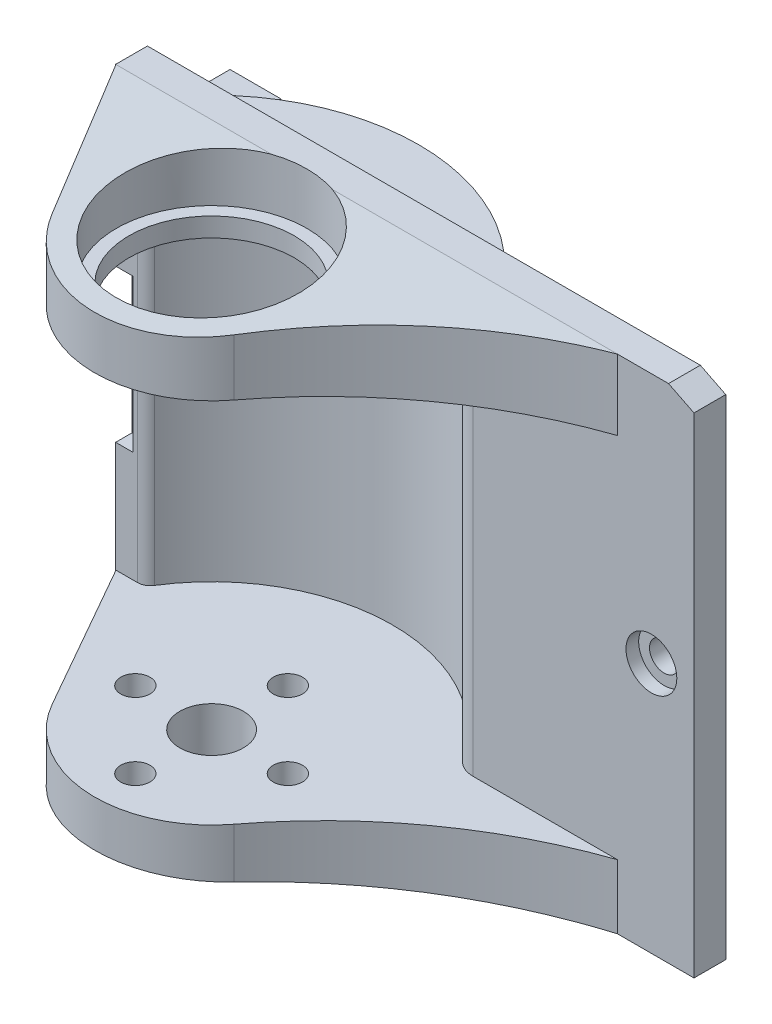
from build123d import *

# Parameters (mm, degrees)
SKETCH_1_R               = 16.3
EXTRUDE_1_DEPTH          = 19.75
SKETCH_2_W               = 46.5
SKETCH_2_H               = 2.5
EXTRUDE_2_DEPTH          = 39.5
SKETCH_3_W               = 54.844436064
SKETCH_3_H               = 25.506740045
CUT_EXTRUDE_1_DEPTH      = 50
EXTRUDE_3_DEPTH          = 5.05
SKETCH_5_R               = 14.25
CUT_EXTRUDE_2_DEPTH      = 29.4
SKETCH_6_R               = 2.5
CUT_EXTRUDE_3_DEPTH      = 50.668048079
CUT_EXTRUDE_6_REACH      = 55.295
SKETCH_9_R               = 7.5
SKETCH_12_R              = 1.15
CUT_EXTRUDE_9_DEPTH      = 41.867774591
SKETCH_13_R              = 2
CUT_EXTRUDE_10_DEPTH     = 1
SKETCH_15_W              = 2.8
SKETCH_15_H              = 12
CUT_EXTRUDE_12_DEPTH     = 1.3
EXTRUDE_5_REACH          = 46.665
EXTRUDE_5_END_RADIUS     = 16.3
SKETCH_16_W              = 4
SKETCH_16_H              = 5
SKETCH_17_W              = 1
SKETCH_17_H              = 2
CUT_EXTRUDE_13_DEPTH     = 2.5
SKETCH_19_R              = 8.51898124
SKETCH_19_R_2            = 6.5
EXTRUDE_6_DEPTH          = 2.25
CUT_EXTRUDE_18_REACH     = 55.295
SKETCH_20_R              = 1.15
PATTERN_CIRCULAR_1_COUNT = 4
CUT_EXTRUDE_8_DEPTH      = 54.084861307
SKETCH_18_W              = 26.346157216
SKETCH_18_H              = 2.75
CUT_EXTRUDE_16_DEPTH     = 12.5
FILLET_1_R               = 2
FILLET_2_R               = 1
SKETCH_21_R              = 2.1
CUT_EXTRUDE_19_DEPTH     = 2.5
CUT_EXTRUDE_START        = -10
SKETCH_22_R              = 7.5
CUT_EXTRUDE_23_DEPTH     = 10
EXTRUDE_START            = -1
SKETCH_23_R              = 7.5
SKETCH_23_R_2            = 6.5
EXTRUDE_7_DEPTH          = 1
MOVE_FACE_3_BY           = 0.5
SKETCH_27_W              = 1
SKETCH_27_H              = 39.5
CUT_EXTRUDE_24_DEPTH     = 41.867774591
CHAMFER_1_SIZE           = 2
CHAMFER_1_SIZE2          = 1


with BuildPart() as part:
    # 草图1 → 凸台-拉伸1 (new, symmetric)
    with BuildSketch(Plane(origin=(0, 0, 0), x_dir=(1, 0, 0), z_dir=(0, 1, 0))):
        with Locations(Location((0, 0, 0), (0, 0, 270))):
            Circle(SKETCH_1_R)
    extrude(amount=EXTRUDE_1_DEPTH, both=True)

    # 草图2 → 凸台-拉伸2 (add, through all)
    with BuildSketch(Plane.XZ.offset(19.75)):
        with Locations((8.6, -8.35)):
            Rectangle(SKETCH_2_W, SKETCH_2_H)
    extrude(amount=-EXTRUDE_2_DEPTH)

    # 草图3 → 切除-拉伸1 (cut)
    with BuildSketch(Plane.XZ.offset(19.75)):
        with Locations((4.427781968, 5.653370022)):
            Rectangle(SKETCH_3_W, SKETCH_3_H)
    extrude(amount=-CUT_EXTRUDE_1_DEPTH, mode=Mode.SUBTRACT)

    # 草图4 → 凸台-拉伸3 (add)
    with BuildSketch(Plane.XZ.offset(19.75)):
        with BuildLine():
            Line((-14.65, -7.146152811), (-7.996542478, 4.549209646))
            ThreePointArc((-7.996542478, 4.549209646), (-0.608425307, 9.179859402), (7.326204954, 5.564775015))
            ThreePointArc((7.326204954, 5.564775015), (15.146356853, -2.073759423), (24.85, -7.107773105))
            Line((24.85, -7.107773105), (-14.65, -7.146152811))
        make_face()
    extrude_3 = extrude(amount=-EXTRUDE_3_DEPTH)

    # 镜向1: 凸台-拉伸3 across plane
    add(extrude_3.mirror(Plane.ZX))

    # 草图5 → 切除-拉伸2 (cut)
    with BuildSketch(Plane(origin=(0, -14.7, 0), x_dir=(1, 0, 0), z_dir=(0, 1, 0))):
        Circle(SKETCH_5_R)
    extrude(amount=CUT_EXTRUDE_2_DEPTH, mode=Mode.SUBTRACT)

    # 草图6 → 切除-拉伸3 (cut, through all)
    with BuildSketch(Plane(origin=(0, -14.7, 0), x_dir=(1, 0, 0), z_dir=(0, 1, 0))):
        with Locations(Location((0, 0, 0), (0, 0, 270))):
            Circle(SKETCH_6_R)
    extrude(amount=-CUT_EXTRUDE_3_DEPTH, mode=Mode.SUBTRACT)

    # 草图9 → 切除-拉伸6 (cut, up to next)
    with BuildSketch(Plane(origin=(0, 19.75, 0), x_dir=(1, 0, 0), z_dir=(0, 1, 0)), mode=Mode.PRIVATE) as cut_extrude_6_sk1:
        with Locations(Location((0, 0, 0), (0, 0, 270))):
            Circle(SKETCH_9_R)
    cut_extrude_6_tool1 = extrude(cut_extrude_6_sk1.sketch, amount=-CUT_EXTRUDE_6_REACH, mode=Mode.PRIVATE) & part.part
    add(cut_extrude_6_tool1.solids().sort_by_distance((0, 19.75, 0))[0], mode=Mode.SUBTRACT)

    # 草图12 → 切除-拉伸9 (cut, through all)
    with BuildSketch(Plane.XY.offset(-7.1)):
        with Locations((27.5, 0)):
            Circle(SKETCH_12_R)
    extrude(amount=-CUT_EXTRUDE_9_DEPTH, mode=Mode.SUBTRACT)

    # 草图13 → 切除-拉伸10 (cut)
    with BuildSketch(Plane.XY.offset(-7.1)):
        with Locations((27.5, 0)):
            Circle(SKETCH_13_R)
    extrude(amount=-CUT_EXTRUDE_10_DEPTH, mode=Mode.SUBTRACT)

    # 草图15 → 切除-拉伸12 (cut)
    with BuildSketch(Plane.XY.offset(-7.1)):
        with Locations((-14.672423113, 0)):
            Rectangle(SKETCH_15_W, SKETCH_15_H)
    extrude(amount=-CUT_EXTRUDE_12_DEPTH, mode=Mode.SUBTRACT)

    # 凸台-拉伸5: up to this cylinder (the profile starts outside it)
    extrude_5_end = Plane(origin=(0, 13.4, 0), z_dir=(0, -1, 0)) * Cylinder(EXTRUDE_5_END_RADIUS, 126.93, mode=Mode.PRIVATE)
    # 草图16 → 凸台-拉伸5 (add, up to the surface)
    with BuildSketch(Plane(origin=(0, 0, -15.1), x_dir=(-1, 0, 0), z_dir=(0, 0, -1)), mode=Mode.PRIVATE) as extrude_5_sk1:
        with Locations((11.65, 13.4)):
            Rectangle(SKETCH_16_W, SKETCH_16_H)
    extrude_5_tool1 = extrude(extrude_5_sk1.sketch, amount=-EXTRUDE_5_REACH, mode=Mode.PRIVATE) - extrude_5_end
    extrude_5 = extrude_5_tool1.solids().sort_by_distance((-11.65, 13.4, -15.1))[0]
    add(extrude_5)

    # 镜向4: 凸台-拉伸5 across plane
    add(extrude_5.mirror(Plane.ZX))

    # 草图17 → 切除-拉伸13 (cut)
    with BuildSketch(Plane(origin=(0, 0, -15.1), x_dir=(-1, 0, 0), z_dir=(0, 0, -1))):
        with Locations((11.65, 13.4)):
            Rectangle(SKETCH_17_W, SKETCH_17_H)
    cut_extrude_13 = extrude(amount=-CUT_EXTRUDE_13_DEPTH, mode=Mode.SUBTRACT)

    # 镜向5: 切除-拉伸13 across plane
    add(cut_extrude_13.mirror(Plane.ZX), mode=Mode.SUBTRACT)

    # 草图19 → 凸台-拉伸6 (add)
    with BuildSketch(Plane(origin=(0, 19.75, 0), x_dir=(1, 0, 0), z_dir=(0, 1, 0))):
        Circle(SKETCH_19_R)
        with Locations(Location((0, 0, 0), (0, 0, 270))):
            Circle(SKETCH_19_R_2, mode=Mode.SUBTRACT)
    extrude(amount=-EXTRUDE_6_DEPTH)

    # 草图20 → 切除-拉伸18 (cut, up to next)
    with BuildSketch(Plane.XZ.offset(19.75), mode=Mode.PRIVATE) as cut_extrude_18_sk1:
        with Locations(Location((0, 6, 0), (0, 0, 270))):
            Circle(SKETCH_20_R)
    cut_extrude_18_tool1 = extrude(cut_extrude_18_sk1.sketch, amount=-CUT_EXTRUDE_18_REACH, mode=Mode.PRIVATE) & part.part
    cut_extrude_18 = cut_extrude_18_tool1.solids().sort_by_distance((0, -19.75, 6))[0]
    add(cut_extrude_18, mode=Mode.SUBTRACT)

    # 阵列(圆周)1: 切除-拉伸18 ×4 about axis
    pattern_circular_1_axis = Axis((0, 0, 0), (0, 1, 0))
    for i in range(1, PATTERN_CIRCULAR_1_COUNT):
        add(cut_extrude_18.rotate(pattern_circular_1_axis, i * 360 / PATTERN_CIRCULAR_1_COUNT), mode=Mode.SUBTRACT)

    # 草图7 → 切除-拉伸8 (cut, through all)
    with BuildSketch(Plane.ZY.offset(14.65)):
        Polygon((-7.1, 19.75), (9.2, 18.323934785), (9.2, 19.75), align=None)
    cut_extrude_8 = extrude(amount=-CUT_EXTRUDE_8_DEPTH, mode=Mode.SUBTRACT)

    # 镜向3: 切除-拉伸8 across plane
    add(cut_extrude_8.mirror(Plane.ZX), mode=Mode.SUBTRACT)

    # 草图18 → 切除-拉伸16 (cut)
    with BuildSketch(Plane(origin=(0, 0, -9.6), x_dir=(-1, 0, 0), z_dir=(0, 0, -1))):
        with Locations((0, 18.375)):
            Rectangle(SKETCH_18_W, SKETCH_18_H)
    cut_extrude_16 = extrude(amount=CUT_EXTRUDE_16_DEPTH, mode=Mode.SUBTRACT)

    # 镜向6: 切除-拉伸16 across plane
    add(cut_extrude_16.mirror(Plane.ZX), mode=Mode.SUBTRACT)

    # 圆角1
    fillet_1_edges = [part.edges().sort_by_distance(p)[0] for p in [
        (12.355262037, 0, -7.1),
    ]]
    fillet(fillet_1_edges, radius=FILLET_1_R)

    # 圆角2
    fillet_2_edges = [part.edges().sort_by_distance(p)[0] for p in [
        (-12.355262037, 0, -7.1),
    ]]
    fillet(fillet_2_edges, radius=FILLET_2_R)

    # 草图21 → 切除-拉伸19 (cut)
    with BuildSketch(Plane.XZ.offset(19.75)):
        with Locations(Location((0, 6, 0), (0, 0, 270))):
            Circle(SKETCH_21_R)
        with Locations(Location((-6, 0, 0), (0, 0, 270))):
            Circle(SKETCH_21_R)
        with Locations(Location((6, 0, 0), (0, 0, 270))):
            Circle(SKETCH_21_R)
        with Locations(Location((0, -6, 0), (0, 0, 270))):
            Circle(SKETCH_21_R)
    extrude(amount=-CUT_EXTRUDE_19_DEPTH, mode=Mode.SUBTRACT)

    # 草图22 → 切除-拉伸23 (cut)
    with BuildSketch(Plane.XZ.offset(-17.5).offset(CUT_EXTRUDE_START)):
        with Locations(Location((0, 0, 0), (0, 0, 90))):
            Circle(SKETCH_22_R)
    extrude(amount=CUT_EXTRUDE_23_DEPTH, mode=Mode.SUBTRACT)

    # 草图23 → 凸台-拉伸7 (add)
    with BuildSketch(Plane.XZ.offset(-14.7).offset(EXTRUDE_START)):
        with Locations(Location((0, 0, 0), (0, 0, 288.796905035))):
            Circle(SKETCH_23_R)
        with Locations(Location((0, 0, 0), (0, 0, 270))):
            Circle(SKETCH_23_R_2, mode=Mode.SUBTRACT)
    extrude(amount=EXTRUDE_7_DEPTH)

    # Move Face 3: a face moved outward by 0.5
    extrude(part.faces().sort_by_distance((5.10183032, 14.7, -8.3875))[0], amount=MOVE_FACE_3_BY, dir=(0, -1, 0))

    # 草图27 → 切除-拉伸24 (cut, through all)
    with BuildSketch(Plane.XY.offset(-7.1)):
        with Locations((31.35, 0)):
            Rectangle(SKETCH_27_W, SKETCH_27_H)
    extrude(amount=-CUT_EXTRUDE_24_DEPTH, mode=Mode.SUBTRACT)

    # 倒角1
    chamfer_1_edges = [part.edges().sort_by_distance(p)[0] for p in [
        (30.85, 19.75, -8.35),
    ]]
    chamfer_1_side = [part.faces().sort_by_distance(p)[0] for p in [
        (8.193237095, 19.75, -8.362550861),
    ]]
    chamfer(chamfer_1_edges, length=CHAMFER_1_SIZE, length2=CHAMFER_1_SIZE2, reference=chamfer_1_side[0])


solid = part.part
